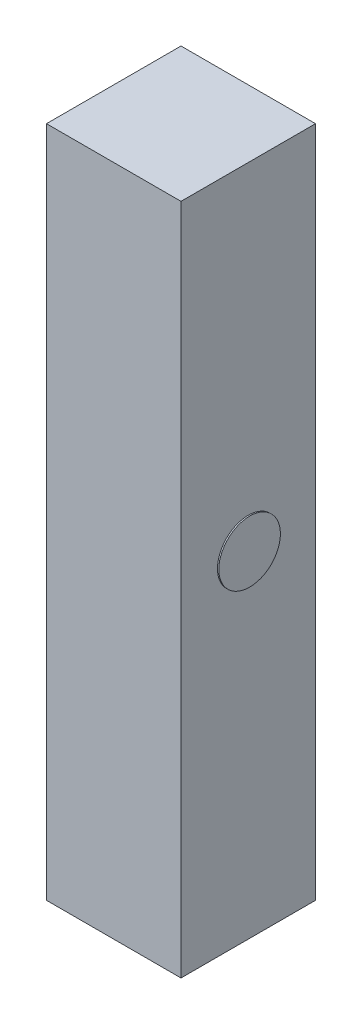
from build123d import *

# Parameters (mm, degrees)
SKETCH1_W           = 1
SKETCH1_H           = 5
BOSS_EXTRUDE1_DEPTH = 1
SKETCH2_R           = 0.228902054
BOSS_EXTRUDE2_DEPTH = 0.01


with BuildPart() as part:
    # Sketch1 → Boss-Extrude1 (new body)
    with BuildSketch(Plane.XY):
        with Locations((0.5, -2.5)):
            Rectangle(SKETCH1_W, SKETCH1_H)
    extrude(amount=BOSS_EXTRUDE1_DEPTH)

    # Sketch2 → Boss-Extrude2 (add)
    with BuildSketch(Plane(origin=(1, 0, 0), x_dir=(0, 0, -1), z_dir=(1, 0, 0))):
        with Locations(Location((-0.5, -2.5, 0), (0, 0, 270))):
            Circle(SKETCH2_R)
    extrude(amount=BOSS_EXTRUDE2_DEPTH)


solid = part.part
